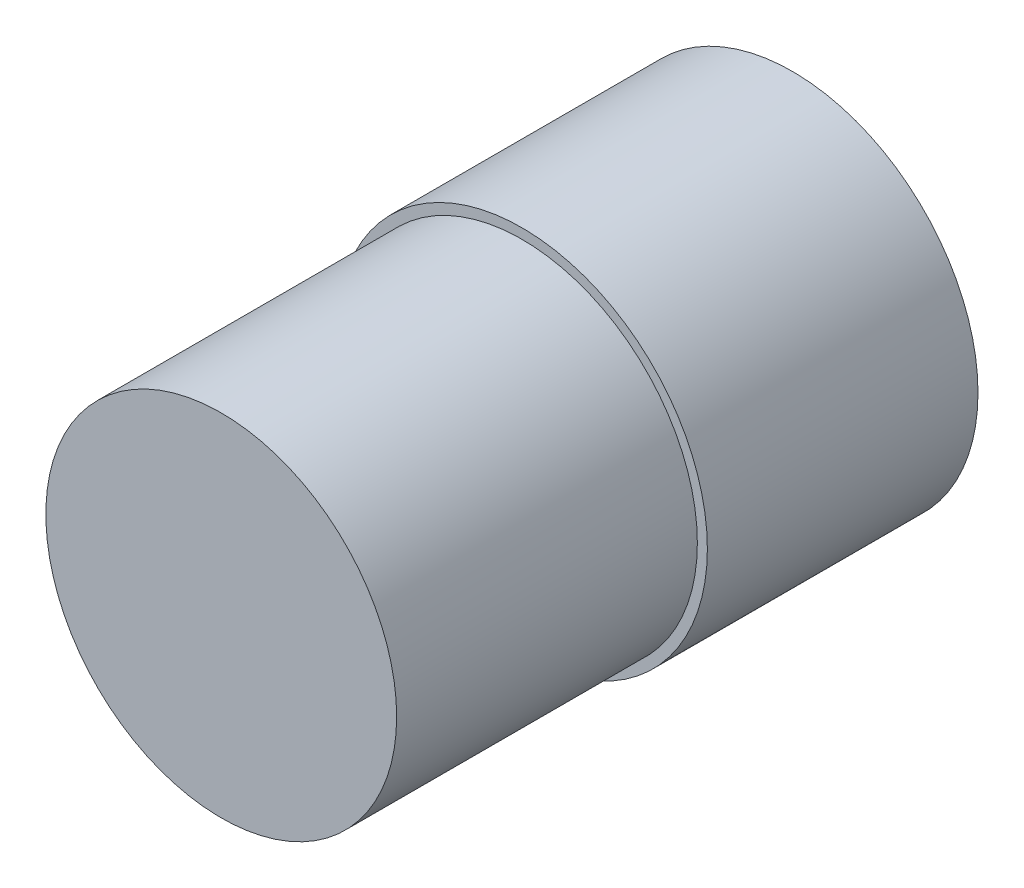
from build123d import *

# Parameters (mm, degrees)
SKETCH_1_R          = 18.5
EXTRUDE_1_DEPTH     = 27
SKETCH_2_R          = 17.5
EXTRUDE_2_DEPTH     = 30
SKETCH_3_R          = 2.75
CUT_EXTRUDE_1_DEPTH = 24.4
SKETCH_4_R          = 1.6
SKETCH_4_R_2        = 2.75
CUT_EXTRUDE_2_DEPTH = 10


with BuildPart() as part:
    # 草图1 → 凸台-拉伸1 (new body)
    with BuildSketch(Plane.XY):
        Circle(SKETCH_1_R)
    extrude(amount=EXTRUDE_1_DEPTH)

    # 草图2 → 凸台-拉伸2 (add)
    with BuildSketch(Plane.XY.offset(27)):
        Circle(SKETCH_2_R)
    extrude(amount=EXTRUDE_2_DEPTH)

    # 草图3 → 切除-拉伸1 (cut)
    with BuildSketch(Plane(origin=(0, 0, 0), x_dir=(-1, 0, 0), z_dir=(0, 0, -1))):
        with Locations((0, -9.25)):
            Circle(SKETCH_3_R)
    extrude(amount=-CUT_EXTRUDE_1_DEPTH, mode=Mode.SUBTRACT)

    # 草图4 → 切除-拉伸2 (cut)
    with BuildSketch(Plane(origin=(0, 0, 0), x_dir=(-1, 0, 0), z_dir=(0, 0, -1))):
        with Locations((-16, -1.25)):
            Circle(SKETCH_4_R)
        with Locations((-8, 11.75)):
            Circle(SKETCH_4_R)
        with Locations((0, -9.25)):
            Circle(SKETCH_4_R_2)
        with Locations(Location((16, -1.25, 0), (0, 0, 180))):
            Circle(SKETCH_4_R)
        with Locations(Location((8, 11.75, 0), (0, 0, 180))):
            Circle(SKETCH_4_R)
    extrude(amount=-CUT_EXTRUDE_2_DEPTH, mode=Mode.SUBTRACT)


solid = part.part
